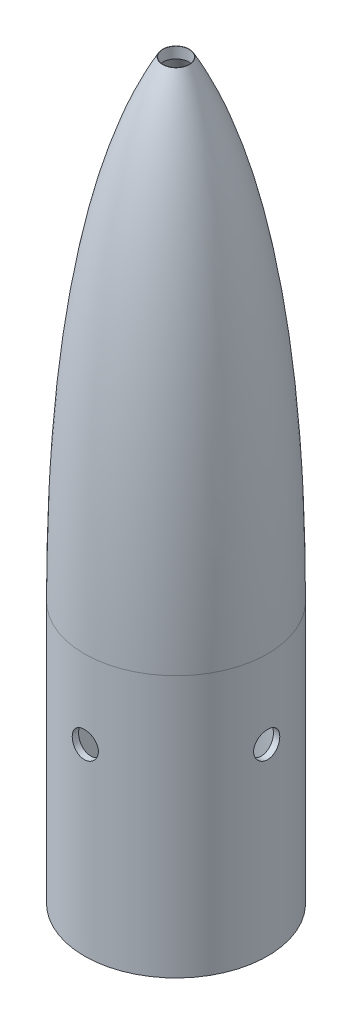
from build123d import *

# Parameters (mm, degrees)
SCHIZZO1_R                    = 17.5
ESTRUSIONE_ESTRUSIONE1_DEPTH  = 50
TAGLIO_ESTRUSIONE1_REACH      = 144.171
SCHIZZO10_R                   = 16.3
TAGLIO_ESTRUSIONE3_DEPTH      = 143.170672106
TAGLIO_ESTRUSIONE3_DEPTH_BACK = 143.170672106
SCHIZZO14_R                   = 2.5
SKETCH1_R                     = 16.3
SKETCH1_R_2                   = 14.8
BOSS_EXTRUDE3_DEPTH           = 15
SKETCH2_R                     = 2.2
BOSS_EXTRUDE4_DEPTH           = 5
CUT_EXTRUDE1_DEPTH            = 146.365917733
CUT_EXTRUDE1_DEPTH_BACK       = 146.365917733
SKETCH4_R                     = 2.5
CUT_EXTRUDE2_DEPTH            = 146.365917738
CUT_EXTRUDE2_DEPTH_BACK       = 146.365917738
SKETCH5_R                     = 2.5


with BuildPart() as part:
    # Schizzo1 → Estrusione-Estrusione1 (new body)
    with BuildSketch(Plane(origin=(0, 0, 0), x_dir=(1, 0, 0), z_dir=(0, 1, 0))):
        with Locations(Location((0, 0, 0), (0, 0, 270))):
            Circle(SCHIZZO1_R)
    extrude(amount=ESTRUSIONE_ESTRUSIONE1_DEPTH)

    # Schizzo7 → Rivoluzione1 (revolve)
    with BuildSketch(Plane.XY):
        with BuildLine():
            Line((0, 140), (-2.55, 140))
            add(Edge.make_bspline(
                [(-2.55, 140), (-17.5, 113.62789219), (-17.5, 50)],
                knots=[0, 0, 0, 1, 1, 1], degree=2))
            Line((-17.5, 50), (-16.3, 50))
            add(Edge.make_bspline(
                [(-2, 138.8), (-16.3, 113.62789219), (-16.3, 50)],
                knots=[0, 0, 0, 1, 1, 1], degree=2))
            Line((-2, 138.8), (0, 138.8))
            Line((0, 138.8), (0, 140))
        make_face()
    revolve(axis=Axis((0, 50, 0), (0, 1, 0)))

    # Schizzo10 → Taglio-Estrusione1 (cut, up to next)
    with BuildSketch(Plane(origin=(0, 0, 0), x_dir=(1, 0, 0), z_dir=(0, 1, 0)), mode=Mode.PRIVATE) as taglio_estrusione1_sk1:
        with Locations(Location((0, 0, 0), (0, 0, 90))):
            Circle(SCHIZZO10_R)
    taglio_estrusione1_tool1 = extrude(taglio_estrusione1_sk1.sketch, amount=TAGLIO_ESTRUSIONE1_REACH, mode=Mode.PRIVATE) & part.part
    add(taglio_estrusione1_tool1.solids().sort_by_distance((0, 0, 0))[0], mode=Mode.SUBTRACT)

    # Schizzo14 → Taglio-Estrusione3 (cut, two sides: drawn at the far end of the back side and taken through both)
    with BuildSketch(Plane(origin=(0, 140, 0), x_dir=(1, 0, 0), z_dir=(0, 1, 0)).offset(-TAGLIO_ESTRUSIONE3_DEPTH_BACK)):
        with Locations(Location((0, 0, 0), (0, 0, 90))):
            Circle(SCHIZZO14_R)
    extrude(amount=TAGLIO_ESTRUSIONE3_DEPTH + TAGLIO_ESTRUSIONE3_DEPTH_BACK, mode=Mode.SUBTRACT)

    # Sketch1 → Boss-Extrude3 (add)
    with BuildSketch(Plane.XZ):
        with Locations(Location((0, 0, 0), (0, 0, 270))):
            Circle(SKETCH1_R)
        with Locations(Location((0, 0, 0), (0, 0, 270))):
            Circle(SKETCH1_R_2, mode=Mode.SUBTRACT)
    extrude(amount=-BOSS_EXTRUDE3_DEPTH)

    # Sketch2 → Boss-Extrude4 (add)
    # profile 1 of 2: a face of its own
    with BuildSketch(Plane.XZ):
        with BuildLine():
            ThreePointArc((8.3, 4.3829214), (3.9170786, 0), (8.3, -4.3829214))
            Line((8.3, -4.3829214), (14.136123938, -4.3829214))
            ThreePointArc((14.136123938, -4.3829214), (14.8, 0), (14.136123938, 4.3829214))
            Line((14.136123938, 4.3829214), (8.3, 4.3829214))
        make_face()
        with Locations(Location((8.3, 0, 0), (0, 0, 270))):
            Circle(SKETCH2_R, mode=Mode.SUBTRACT)
    # profile 2 of 2: a face of its own
    with BuildSketch(Plane.XZ):
        with BuildLine():
            Line((-8.3, 4.3829214), (-14.136123938, 4.3829214))
            ThreePointArc((-14.136123938, 4.3829214), (-14.8, 0), (-14.136123938, -4.3829214))
            Line((-14.136123938, -4.3829214), (-8.3, -4.3829214))
            ThreePointArc((-8.3, -4.3829214), (-3.9170786, 0), (-8.3, 4.3829214))
        make_face()
        with Locations(Location((-8.3, 0, 0), (0, 0, 270))):
            Circle(SKETCH2_R, mode=Mode.SUBTRACT)
    extrude(amount=-BOSS_EXTRUDE4_DEPTH)

    # Sketch4 → Cut-Extrude1 (cut, two sides: drawn at the far end of the back side and taken through both)
    with BuildSketch(Plane.XY.offset(17.5).offset(-CUT_EXTRUDE1_DEPTH_BACK)):
        with Locations((0, 35)):
            Circle(SKETCH4_R)
    extrude(amount=CUT_EXTRUDE1_DEPTH + CUT_EXTRUDE1_DEPTH_BACK, mode=Mode.SUBTRACT)

    # Sketch5 → Cut-Extrude2 (cut, two sides: drawn at the far end of the back side and taken through both)
    with BuildSketch(Plane(origin=(17.5, 0, 0), x_dir=(0, 0, -1), z_dir=(1, 0, 0)).offset(-CUT_EXTRUDE2_DEPTH_BACK)):
        with Locations((0, 35)):
            Circle(SKETCH5_R)
    extrude(amount=CUT_EXTRUDE2_DEPTH + CUT_EXTRUDE2_DEPTH_BACK, mode=Mode.SUBTRACT)


solid = part.part
